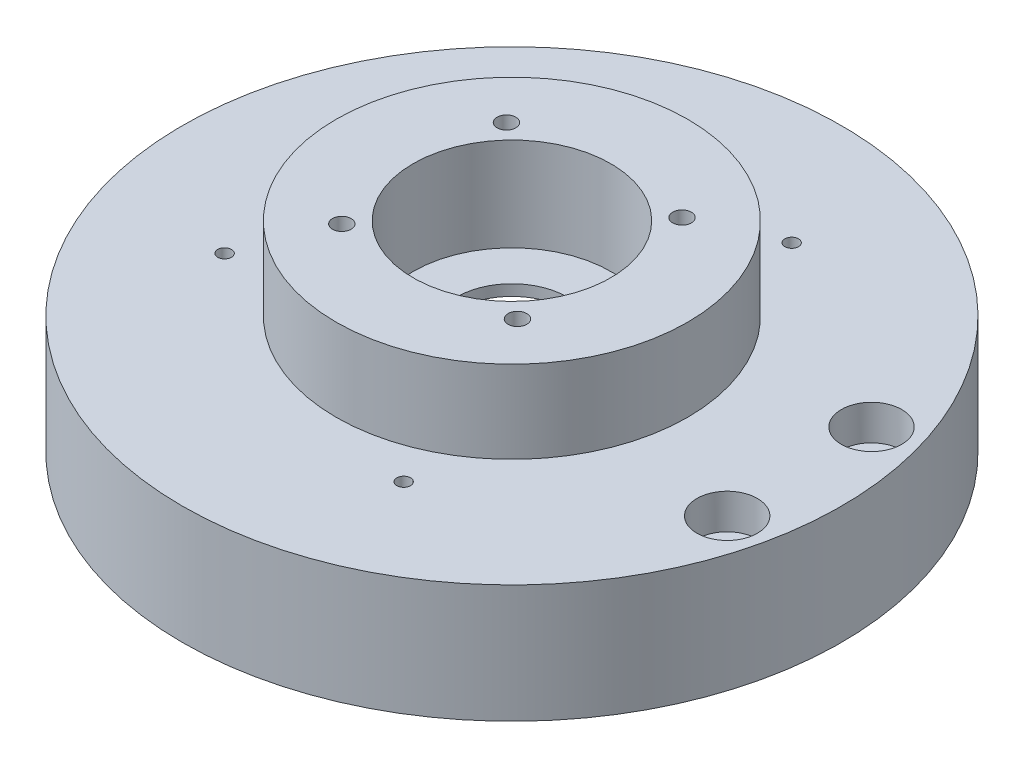
from build123d import *

# Parameters (mm, degrees)
SKETCH1_R                                           = 60
BOSS_EXTRUDE1_DEPTH                                 = 36.5
SKETCH2_R                                           = 55
SKETCH2_R_2                                         = 50
CUT_EXTRUDE1_DEPTH                                  = 5
SKETCH5_W                                           = 18
SKETCH5_H                                           = 17
CBORE_FOR_M6_HEX_SOCKET_HEAD_CAP_SCREW1_D           = 6.4
CBORE_FOR_M6_HEX_SOCKET_HEAD_CAP_SCREW1_CBORE_D     = 11
CBORE_FOR_M6_HEX_SOCKET_HEAD_CAP_SCREW1_CBORE_DEPTH = 21.4
M3_CLEARANCE_HOLE1_D                                = 3.4
CBORE_FOR_M3_HEX_SOCKET_HEAD_CAP_SCREW1_D           = 3.4
CBORE_FOR_M3_HEX_SOCKET_HEAD_CAP_SCREW1_CBORE_D     = 6.5
CBORE_FOR_M3_HEX_SOCKET_HEAD_CAP_SCREW1_CBORE_DEPTH = 5.4
SKETCH12_W                                          = 28
SKETCH12_H                                          = 15
M3_TAPPED_HOLE1_D                                   = 2.5
M3_TAPPED_HOLE1_DEPTH                               = 7.5
M3_TAPPED_HOLE1_TIP                                 = 0.751075774


with BuildPart() as part:
    # Sketch1 → Boss-Extrude1 (new body)
    with BuildSketch(Plane(origin=(0, 0, 0), x_dir=(1, 0, 0), z_dir=(0, 1, 0))):
        with Locations(Location((0, 0, 0), (0, 0, 270))):
            Circle(SKETCH1_R)
    extrude(amount=BOSS_EXTRUDE1_DEPTH)

    # Sketch2 → Cut-Extrude1 (cut)
    with BuildSketch(Plane(origin=(0, 0, 0), x_dir=(-1, 0, 0), z_dir=(0, -1, 0))):
        with Locations(Location((0, 0, 0), (0, 0, 90))):
            Circle(SKETCH2_R)
        with Locations(Location((0, 0, 0), (0, 0, 90))):
            Circle(SKETCH2_R_2, mode=Mode.SUBTRACT)
    extrude(amount=-CUT_EXTRUDE1_DEPTH, mode=Mode.SUBTRACT)

    # Sketch4 → Cut-Revolve1 (revolve, cut)
    with BuildSketch(Plane.XY, mode=Mode.PRIVATE) as cut_revolve1_sk:
        Polygon((42, 0), (42, 9), (32.5, 9), (32.5, 16.5), (29, 16.5), (29, 17.5), (10, 17.5), (10, 30.321453401), (0, 30.321453401), (0, 0), align=None)
    revolve(cut_revolve1_sk.sketch.rotate(Axis((0, 0, 0), (0, 1, 0)), 90), axis=Axis((0, 0, 0), (0, 1, 0)), mode=Mode.SUBTRACT)

    # Sketch5 → Cut-Revolve2 (revolve, cut)
    with BuildSketch(Plane.XY, mode=Mode.PRIVATE) as cut_revolve2_sk:
        with Locations((9, 28)):
            Rectangle(SKETCH5_W, SKETCH5_H)
    revolve(cut_revolve2_sk.sketch.rotate(Axis((0, 36.5, 0), (0, -1, 0)), 270), axis=Axis((0, 36.5, 0), (0, -1, 0)), mode=Mode.SUBTRACT)

    # CBORE for M6 Hex Socket Head Cap Screw1 (through all)
    with Locations(Plane(origin=(0, 36.5, 0), x_dir=(1, 0, 0), z_dir=(0, 1, 0))):
        with Locations((51.124173651, -11.94022062), (50.24494344, 15.221552442)):
            CounterBoreHole(CBORE_FOR_M6_HEX_SOCKET_HEAD_CAP_SCREW1_D / 2, CBORE_FOR_M6_HEX_SOCKET_HEAD_CAP_SCREW1_CBORE_D / 2, CBORE_FOR_M6_HEX_SOCKET_HEAD_CAP_SCREW1_CBORE_DEPTH)

    # M3 Clearance Hole1 (through all)
    with Locations(Plane(origin=(0, 36.5, 0), x_dir=(1, 0, 0), z_dir=(0, 1, 0))):
        with Locations((14.984608584, 15.987169155), (15.987169155, -14.984608584), (-14.984608584, -15.987169155), (-15.987169155, 14.984608584)):
            Hole(M3_CLEARANCE_HOLE1_D / 2)

    # CBORE for M3 Hex Socket Head Cap Screw1 (through all)
    with Locations(Plane(origin=(0, 17.5, 0), x_dir=(-1, 0, 0), z_dir=(0, -1, 0))):
        with Locations((15.987169155, 14.984608584), (-14.984608584, 15.987169155), (-15.987169155, -14.984608584), (14.984608584, -15.987169155)):
            CounterBoreHole(CBORE_FOR_M3_HEX_SOCKET_HEAD_CAP_SCREW1_D / 2, CBORE_FOR_M3_HEX_SOCKET_HEAD_CAP_SCREW1_CBORE_D / 2, CBORE_FOR_M3_HEX_SOCKET_HEAD_CAP_SCREW1_CBORE_DEPTH)

    # Sketch12 → Cut-Revolve3 (revolve, cut)
    with BuildSketch(Plane.XY, mode=Mode.PRIVATE) as cut_revolve3_sk:
        with Locations((-46, 29)):
            Rectangle(SKETCH12_W, SKETCH12_H)
    revolve(cut_revolve3_sk.sketch.rotate(Axis((0, 36.5, 0), (0, -1, 0)), 270), axis=Axis((0, 36.5, 0), (0, -1, 0)), mode=Mode.SUBTRACT)

    # M3 Tapped Hole1
    with Locations(Plane(origin=(0, 21.5, 0), x_dir=(1, 0, 0), z_dir=(0, 1, 0))):
        with Locations((13.936224468, 36.986582332), (-36.986582332, 13.936224468), (-36.007862005, -16.299064354), (16.299064354, -36.007862005)):
            Hole(M3_TAPPED_HOLE1_D / 2, depth=M3_TAPPED_HOLE1_DEPTH)
            with Locations((0, 0, -(M3_TAPPED_HOLE1_DEPTH + M3_TAPPED_HOLE1_TIP / 2))):  # 118° drill point
                Cone(0, M3_TAPPED_HOLE1_D / 2, M3_TAPPED_HOLE1_TIP, mode=Mode.SUBTRACT)


solid = part.part
